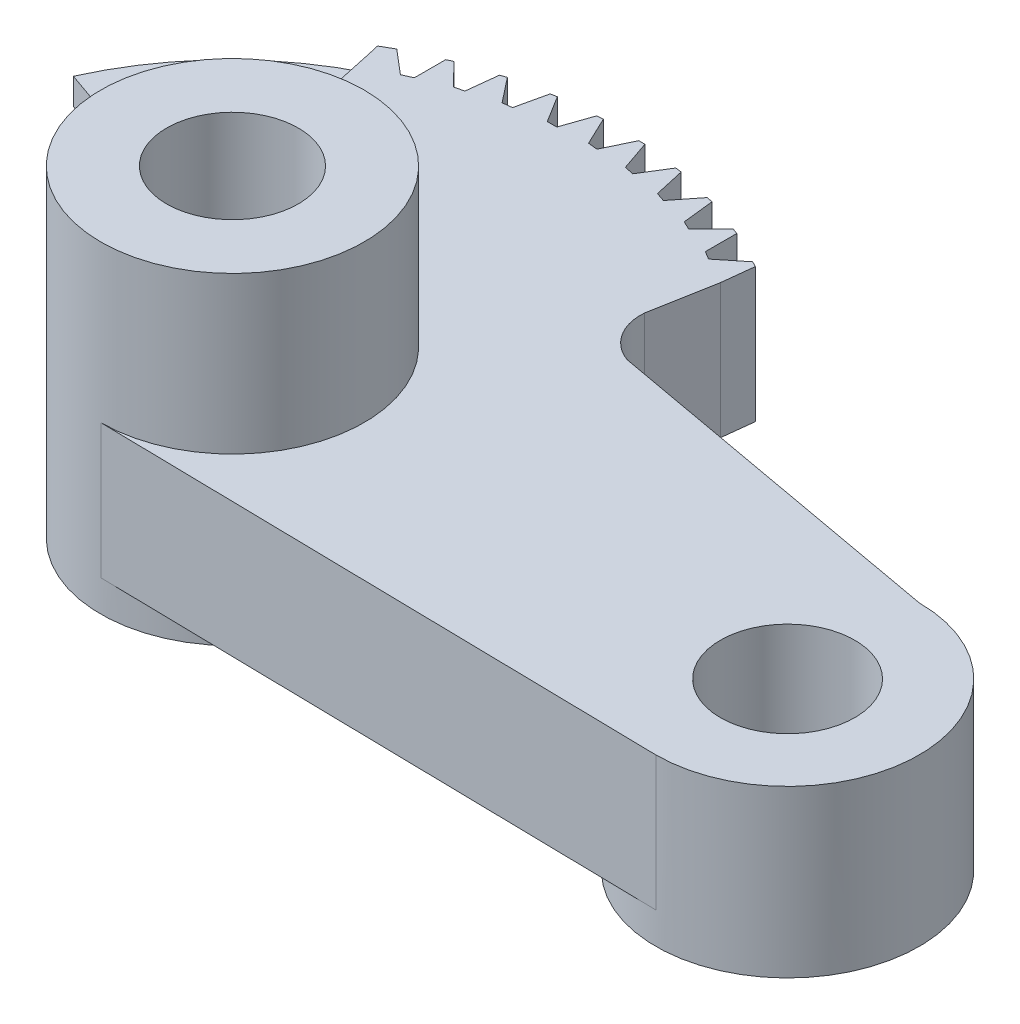
from build123d import *

# Parameters (mm, degrees)
SKETCH_1_R          = 2.5499999999999994
SKETCH_1_R_2        = 2.5499999999999976
EXTRUDE_1_DEPTH     = 5.1
SKETCH_2_R          = 4.999999999999998
SKETCH_2_R_2        = 2.5
EXTRUDE_2_DEPTH     = 5.94
CUT_EXTRUDE_1_DEPTH = 3.5
CUT_EXTRUDE_START   = -0.6
CUT_EXTRUDE_3_DEPTH = 0.6
EXTRUDE_START       = 1.2
SKETCH_6_R          = 4.999999999999998
SKETCH_6_R_2        = 2.5
SKETCH_6_R_3        = 5
SKETCH_6_R_4        = 2.4999999999999987
EXTRUDE_4_DEPTH     = 1.2


with BuildPart() as part:
    # Эскиз1 → Бобышка-Вытянуть1 (new body)
    with BuildSketch(Plane(origin=(0, 0, 0), x_dir=(1, 0, 0), z_dir=(0, 1, 0))):
        with BuildLine():
            Line((6.718023264525762, 8.928267668376021), (7.161238337218641, 11.37785065819786))
            Line((7.161238337218641, 11.37785065819786), (7.294846288705666, 12.560700282216452))
            Line((7.294846288705666, 12.560700282216452), (7.085001061393901, 12.665407082864023))
            Line((7.085001061393901, 12.665407082864023), (6.15987792536569, 11.916319971156167))
            Line((6.15987792536569, 11.916319971156167), (5.853623131200735, 12.10383694173367))
            Line((5.853623131200735, 12.10383694173367), (5.855060736117009, 13.29420757772634))
            Line((5.855060736117009, 13.29420757772634), (5.634886528714601, 13.37496556136943))
            Line((5.634886528714601, 13.37496556136943), (4.798663389284832, 12.527784837542624))
            Line((4.798663389284832, 12.527784837542624), (4.473480547373511, 12.680135526842204))
            Line((4.473480547373511, 12.680135526842204), (4.342730025112913, 13.863304415323501))
            Line((4.342730025112913, 13.863304415323501), (4.114949999467502, 13.919114749889351))
            Line((4.114949999467502, 13.919114749889351), (3.3779694438823102, 12.984318526945106))
            Line((3.3779694438823102, 12.984318526945106), (3.0378804853992434, 13.099618628946285))
            Line((3.0378804853992434, 13.099618628946285), (2.776558986480811, 14.260952083189514))
            Line((2.776558986480811, 14.260952083189514), (2.54399037483231, 14.291124494483034))
            Line((2.54399037483231, 14.291124494483034), (1.9153675367628848, 13.280274532718662))
            Line((1.9153675367628848, 13.280274532718662), (1.56457875493138, 13.35709799101592))
            Line((1.56457875493138, 13.35709799101592), (1.175918359734634, 14.482232389631033))
            Line((1.175918359734634, 14.482232389631033), (0.9414376205823001, 14.486393698794194))
            Line((0.9414376205823001, 14.486393698794194), (0.4289474421954887, 13.411992407470256))
            Line((0.42894744219548875, 13.411992407470256), (0.07179746795026506, 13.449389053044667))
            Line((0.07179746795026506, 13.449389053044667), (-0.4393947883485354, 14.524408492330128))
            Line((-0.43939478834853546, 14.524408492330128), (-0.6728875469021285, 14.502507231398162))
            Line((-0.6728875469021285, 14.502507231398162), (-1.062906477097084, 13.377843036257644))
            Line((-1.062906477097084, 13.377843036257644), (-1.4220003362283888, 13.375350339371238))
            Line((-1.4220003362283888, 13.375350339371238), (-2.049401918098927, 14.386958748197415))
            Line((-2.049401918098927, 14.386958748197415), (-2.279018807507275, 14.33926579666565))
            Line((-2.279018807507275, 14.33926579666565), (-2.5417426516817105, 13.178248785832608))
            Line((-2.5417426516817105, 13.178248785832608), (-2.898339045786024, 13.13589757669542))
            Line((-2.898339045786024, 13.13589757669542), (-3.6341901158202092, 14.071583165165732))
            Line((-3.6341901158202092, 14.071583165165732), (-3.8570911851181764, 13.998688399693854))
            Line((-3.8570911851181764, 13.998688399693854), (-3.989270518385492, 12.815678280718325))
            Line((-3.989270518385492, 12.815678280718325), (-4.3389589867331635, 12.733992368173748))
            Line((-4.3389589867331635, 12.733992368173748), (-5.174158380979493, 13.582182376127184))
            Line((-5.174158380979493, 13.582182376127184), (-5.3875867419063175, 13.48498737481814))
            Line((-5.3875867419063175, 13.48498737481814), (-5.3875867419063175, 12.2946158707315))
            Line((-5.3875867419063175, 12.2946158707315), (-5.751610974482103, 12.12883970299033))
            Line((-5.751610974482103, 12.12883970299033), (-6.666748566138722, 12.905854249247858))
            Line((-6.666748566138722, 12.905854249247858), (-7.13096440438616, 12.63943472468846))
            Line((-7.13096440438616, 12.63943472468846), (-7.025830916712447, 12.175864106991055))
            ThreePointArc((-7.025830916712449, 12.175864106991055), (-10.264322646127633, 9.799709596012173), (-12.51111253150909, 6.470163958468902))
            Line((-12.51111253150909, 6.470163958468902), (-5.241071220187256, 3.924995297345621))
            Line((-5.241071220187256, 3.924995297345621), (-4.737733567637334, 1.5980865565051285))
            ThreePointArc((-4.737733567637334, 1.5980865565051288), (-4.061430338102922, -2.9162962141622684), (1.55e-15, -5))
            Line((2.2e-16, -5), (21.46693589645179, -5.388260461869603))
            ThreePointArc((21.46693589645179, -5.388260461869605), (26.46693589645179, -0.3882604618696045), (21.46693589645179, 4.611739538130397))
            Line((21.46693589645179, 4.611739538130397), (7.924308406385933, 7.062073595968816))
            ThreePointArc((7.924308406385932, 7.062073595968816), (7.00463576208043, 7.790569444059032), (6.718023264525762, 8.928267668376021))
        make_face()
        with Locations(Location((21.46693589645179, -0.3882604618696021, 0), (0, 0, 270))):
            Circle(SKETCH_1_R, mode=Mode.SUBTRACT)
        with Locations(Location((2.78e-15, 1.83e-15, 0), (0, 0, 270))):
            Circle(SKETCH_1_R_2, mode=Mode.SUBTRACT)
    extrude(amount=EXTRUDE_1_DEPTH)

    # Эскиз2 → Бобышка-Вытянуть2 (add)
    with BuildSketch(Plane(origin=(0, 5.1, 0), x_dir=(1, 0, 0), z_dir=(0, 1, 0))):
        with Locations(Location((0, 0, 0), (0, 0, 270))):
            Circle(SKETCH_2_R)
        with Locations(Location((0, 0, 0), (0, 0, 270))):
            Circle(SKETCH_2_R_2, mode=Mode.SUBTRACT)
    extrude(amount=EXTRUDE_2_DEPTH)

    # Эскиз4 → Вырез-Вытянуть1 (cut)
    with BuildSketch(Plane.XZ):
        with BuildLine():
            Line((-5.241071220187255, -3.924995297345621), (-7.025830916712447, -12.175864106991055))
            ThreePointArc((-7.025830916712447, -12.175864106991055), (-10.264322646127628, -9.799709596012166), (-12.511112531509088, -6.470163958468901))
            Line((-12.511112531509088, -6.470163958468901), (-5.241071220187255, -3.924995297345621))
        make_face()
    extrude(amount=-CUT_EXTRUDE_1_DEPTH, mode=Mode.SUBTRACT)

    # Эскиз5 → Вырез-Вытянуть3 (cut)
    with BuildSketch(Plane(origin=(0, 5.1, 0), x_dir=(1, 0, 0), z_dir=(0, 1, 0)).offset(CUT_EXTRUDE_START)):
        with BuildLine():
            Line((-5.241071220187255, 3.924995297345621), (-7.025830916712447, 12.175864106991055))
            ThreePointArc((-7.025830916712447, 12.175864106991055), (-10.264322646127628, 9.799709596012168), (-12.511112531509088, 6.470163958468901))
            Line((-12.511112531509088, 6.470163958468901), (-5.241071220187255, 3.924995297345621))
        make_face()
    extrude(amount=CUT_EXTRUDE_3_DEPTH, mode=Mode.SUBTRACT)

    # Эскиз6 → Бобышка-Вытянуть4 (add)
    # profile 1 of 2: a face of its own
    with BuildSketch(Plane.XZ.offset(EXTRUDE_START)):
        with Locations(Location((0, 0, 0), (0, 0, 270))):
            Circle(SKETCH_6_R)
        with Locations(Location((0, 0, 0), (0, 0, 90))):
            Circle(SKETCH_6_R_2, mode=Mode.SUBTRACT)
    # profile 2 of 2: a face of its own
    with BuildSketch(Plane.XZ.offset(EXTRUDE_START)):
        with Locations(Location((21.46693589645179, 0.38826046186960295, 0), (0, 0, 270))):
            Circle(SKETCH_6_R_3)
        with Locations(Location((21.46693589645179, 0.38826046186960295, 0), (0, 0, 270))):
            Circle(SKETCH_6_R_4, mode=Mode.SUBTRACT)
    extrude(amount=-EXTRUDE_4_DEPTH)


solid = part.part
